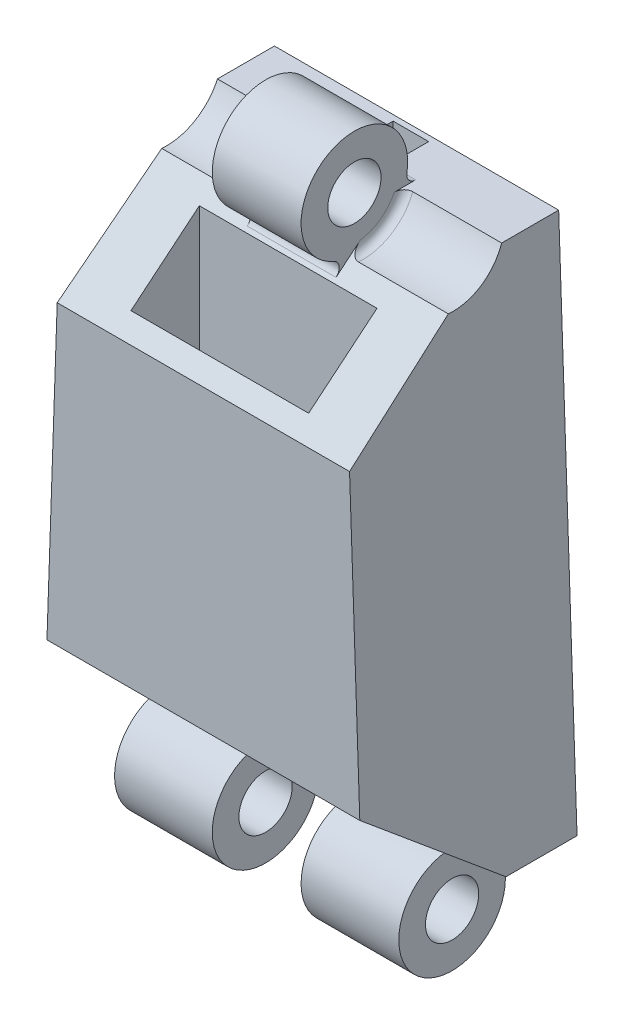
from build123d import *

# Parameters (mm, degrees)
BOSS_EXTRUDE2_DEPTH            = 12
CUT_EXTRUDE2_DEPTH             = 22.571014648492383
CUT_EXTRUDE2_DEPTH_BACK        = 22.571014648492383
SKETCH17_R                     = 3.0000000000000298
SKETCH17_R_2                   = 1.5
BOSS_EXTRUDE3_DEPTH            = 2.5
CUT_EXTRUDE3_DEPTH             = 25.679395227729078
CUT_EXTRUDE3_DEPTH_BACK        = 25.679395227729078
SKETCH19_R                     = 1.4999999999999996
BOSS_EXTRUDE4_DEPTH            = 8
SKETCH19_3_R                   = 3.0000000000000004
CUT_EXTRUDE4_DEPTH             = 2.5
CUT_EXTRUDE5_START             = 10
SKETCH20_R                     = 2.9999999999999996
CUT_EXTRUDE5_DEPTH             = 10
SKETCH21_R                     = 2.999999999999999
CUT_EXTRUDE6_DEPTH             = 10
FILLET6_R                      = 0.5000000000000004
FILLET7_R                      = 0.5000000000000004
FILLET8_R                      = 0.5000000000000004
CUT_EXTRUDE7_REACH             = 27.076
CUT_EXTRUDE7_DIRECTION_2_REACH = 27.076
SKETCH25_W                     = 2
SKETCH25_H                     = 33.99035811139369
CUT_EXTRUDE8_DEPTH             = 1


with BuildPart() as part:
    # Sketch1 → Boss-Extrude2 (new body)
    with BuildSketch(Plane.XY):
        Polygon((-7.999999999999995, -14.500000000000002), (-6.966131724806635, 15.482179980607619), (9.033868275193369, 15.482179980607619), (10.067736550386755, -14.500000000000002), align=None)
    extrude(amount=BOSS_EXTRUDE2_DEPTH)

    # Sketch16 → Cut-Extrude2 (cut, two sides: drawn at the far end of the back side and taken through both)
    with BuildSketch(Plane(origin=(1.0338682751933665, 0, 0), x_dir=(0, 0, -1), z_dir=(1, 0, 0)).offset(-CUT_EXTRUDE2_DEPTH_BACK)):
        Polygon((-12, 8.852541981440545), (-4, 15.482179980607619), (-12, 15.482179980607619), align=None)
    extrude(amount=CUT_EXTRUDE2_DEPTH + CUT_EXTRUDE2_DEPTH_BACK, mode=Mode.SUBTRACT)

    # Sketch17 → Boss-Extrude3 (add, symmetric)
    with BuildSketch(Plane(origin=(1.0338682751933665, 0, 0), x_dir=(0, 0, -1), z_dir=(1, 0, 0))):
        with Locations((-6.000000000000029, 16.582179980607627)):
            Circle(SKETCH17_R)
        with Locations((-6.000000000000001, 16.58217998060762)):
            Circle(SKETCH17_R_2, mode=Mode.SUBTRACT)
    extrude(amount=BOSS_EXTRUDE3_DEPTH, both=True)

    # Sketch18 → Cut-Extrude3 (cut, two sides: drawn at the far end of the back side and taken through both)
    with BuildSketch(Plane(origin=(1.0338682751933665, 0, 0), x_dir=(0, 0, -1), z_dir=(1, 0, 0)).offset(-CUT_EXTRUDE3_DEPTH_BACK)):
        Polygon((-12, -14.500000000000002), (-4, -14.500000000000002), (-12, -7.870362000832929), align=None)
    extrude(amount=CUT_EXTRUDE3_DEPTH + CUT_EXTRUDE3_DEPTH_BACK, mode=Mode.SUBTRACT)

    # Sketch19 → Boss-Extrude4 (add, symmetric)
    with BuildSketch(Plane(origin=(1.0338682751933665, 0, 0), x_dir=(0, 0, -1), z_dir=(1, 0, 0))):
        with BuildLine():
            ThreePointArc((-8.791057147390573, -14.500000000000002), (-6.5598341530436866, -18.547301430306355), (-2.9999999999999996, -15.600000000000003))
            ThreePointArc((-2.9999999999999996, -15.600000000000003), (-3.0526985696936495, -15.040165846956317), (-3.2089428526094275, -14.500000000000002))
            ThreePointArc((-3.2089428526094275, -14.500000000000002), (-6, -12.600000000000003), (-8.791057147390573, -14.500000000000002))
        make_face()
        with Locations((-6, -15.600000000000003)):
            Circle(SKETCH19_R, mode=Mode.SUBTRACT)
    extrude(amount=BOSS_EXTRUDE4_DEPTH, both=True)

    # Sketch19<3> → Cut-Extrude4 (cut, symmetric)
    with BuildSketch(Plane(origin=(1.0338682751933665, 0, 0), x_dir=(0, 0, -1), z_dir=(1, 0, 0))):
        with Locations((-6, -15.600000000000003)):
            Circle(SKETCH19_3_R)
    extrude(amount=CUT_EXTRUDE4_DEPTH, both=True, mode=Mode.SUBTRACT)

    # Sketch20 → Cut-Extrude5 (cut)
    with BuildSketch(Plane(origin=(3.5338682751933668, 0, 0), x_dir=(0, 0, -1), z_dir=(1, 0, 0)).offset(CUT_EXTRUDE5_START)):
        with Locations((-6, 16.58217998060762)):
            Circle(SKETCH20_R)
    extrude(amount=-CUT_EXTRUDE5_DEPTH, mode=Mode.SUBTRACT)

    # Sketch21 → Cut-Extrude6 (cut)
    with BuildSketch(Plane.ZY.offset(1.4661317248066335)):
        with Locations((6, 16.58217998060762)):
            Circle(SKETCH21_R)
    extrude(amount=CUT_EXTRUDE6_DEPTH, mode=Mode.SUBTRACT)

    # Fillet6
    fillet6_edges = [part.edges().sort_by_distance(p)[0] for p in [
        (1.0338682751933665, 13.59501804601977, 6.277242811538059),
    ]]
    fillet(fillet6_edges, radius=FILLET6_R)

    # Fillet7
    fillet7_edges = [part.edges().sort_by_distance(p)[0] for p in [
        (1.0338682751933665, 15.482179980607619, 3.208942852609428),
    ]]
    fillet(fillet7_edges, radius=FILLET7_R)

    # Fillet8
    fillet8_edges = [part.edges().sort_by_distance(p)[0] for p in [
        (3.5338682751933668, 14.026824950601753, 4.428325520146199),
        (-1.4661317248066335, 14.026824950601755, 4.428325520146199),
    ]]
    fillet(fillet8_edges, radius=FILLET8_R)

    # Cut-Extrude7: up to this plane
    cut_extrude7_end = Plane(origin=(-7.999999999999995, 11.14390488681771, 9.23500691209379), z_dir=(0, 0.769971126082772, 0.6380787294674758))
    # Sketch24 → Cut-Extrude7 (cut, up to the surface)
    with BuildSketch(Plane(origin=(0, 0, 0), x_dir=(1, 0, 0), z_dir=(0, 1, 0)), mode=Mode.PRIVATE) as cut_extrude7_sk1:
        Polygon((-3.9661317248066337, -7.226179018286816), (-3.9661317248066337, -11.076034648700675), (6.033868275193367, -11.076034648700674), (6.033868275193367, -7.226179018286816), align=None)
    cut_extrude7_tool1 = split(extrude(cut_extrude7_sk1.sketch, amount=CUT_EXTRUDE7_REACH, mode=Mode.PRIVATE), bisect_by=cut_extrude7_end, keep=Keep.BOTH, mode=Mode.PRIVATE)
    add(cut_extrude7_tool1.solids().sort_by_distance((1.033868, 0, 9.151107))[0], mode=Mode.SUBTRACT)

    # Cut-Extrude7 direction 2: up to this plane
    cut_extrude7_direction_2_end = Plane(origin=(-7.999999999999995, -10.561614048947142, 8.752459728929596), z_dir=(0, 0.769971126082772, -0.6380787294674758))
    # Sketch24 → Cut-Extrude7 direction 2 (cut, up to the surface)
    with BuildSketch(Plane(origin=(0, 0, 0), x_dir=(1, 0, 0), z_dir=(0, 1, 0)), mode=Mode.PRIVATE) as cut_extrude7_direction_2_sk1:
        Polygon((-3.9661317248066337, -7.226179018286816), (-3.9661317248066337, -11.076034648700675), (6.033868275193367, -11.076034648700674), (6.033868275193367, -7.226179018286816), align=None)
    cut_extrude7_direction_2_tool1 = split(extrude(cut_extrude7_direction_2_sk1.sketch, amount=-CUT_EXTRUDE7_DIRECTION_2_REACH, mode=Mode.PRIVATE), bisect_by=cut_extrude7_direction_2_end, keep=Keep.BOTH, mode=Mode.PRIVATE)
    add(cut_extrude7_direction_2_tool1.solids().sort_by_distance((1.033868, 0, 9.151107))[0], mode=Mode.SUBTRACT)

    # Sketch25 → Cut-Extrude8 (cut, symmetric)
    with BuildSketch(Plane(origin=(1.0338682751933665, 0, 0), x_dir=(0, 0, -1), z_dir=(1, 0, 0))):
        with Locations((-1.3199999999999998, 2.495179055696844)):
            Rectangle(SKETCH25_W, SKETCH25_H)
    extrude(amount=CUT_EXTRUDE8_DEPTH, both=True, mode=Mode.SUBTRACT)


solid = part.part
